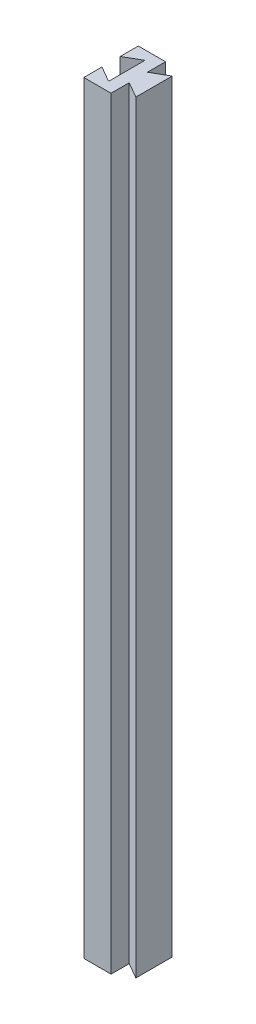
from build123d import *

# Parameters (mm, degrees)
BOSS_EXTRUDE1_DEPTH = 355.6


with BuildPart() as part:
    # Sketch1 → Boss-Extrude1 (new body)
    with BuildSketch(Plane(origin=(0, 0, 0), x_dir=(1, 0, 0), z_dir=(0, 1, 0))):
        Polygon((-33.095309751, 6.967176418), (-33.095309751, -1.499490249), (-25.762961333, 2.733843085), (-25.762961333, -14.199490249), (-33.095309751, -9.966156915), (-33.095309751, -18.432823582), (-45.795309751, -18.432823582), (-45.795309751, -9.966156915), (-38.462961333, -14.199490249), (-38.462961333, 2.733843085), (-45.795309751, -1.499490249), (-45.795309751, 6.967176418), align=None)
    extrude(amount=BOSS_EXTRUDE1_DEPTH)


solid = part.part
